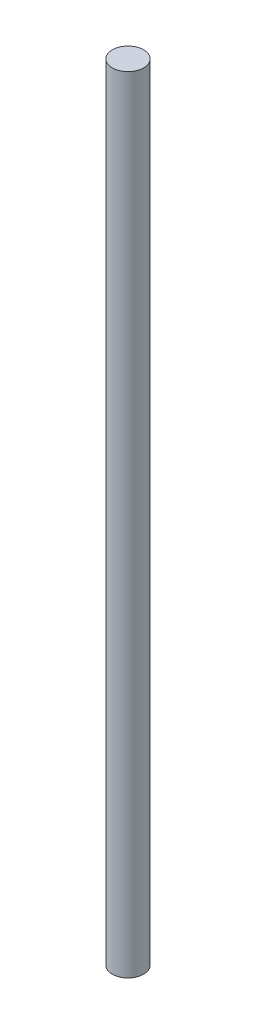
from build123d import *

# Parameters (mm, degrees)
SKETCH1_R           = 200
BOSS_EXTRUDE1_DEPTH = 10000


with BuildPart() as part:
    # Sketch1 → Boss-Extrude1 (new body)
    with BuildSketch(Plane(origin=(0, 0, 0), x_dir=(1, 0, 0), z_dir=(0, 1, 0))):
        with Locations(Location((0, 0, 0), (0, 0, 270))):
            Circle(SKETCH1_R)
    extrude(amount=BOSS_EXTRUDE1_DEPTH)


solid = part.part
